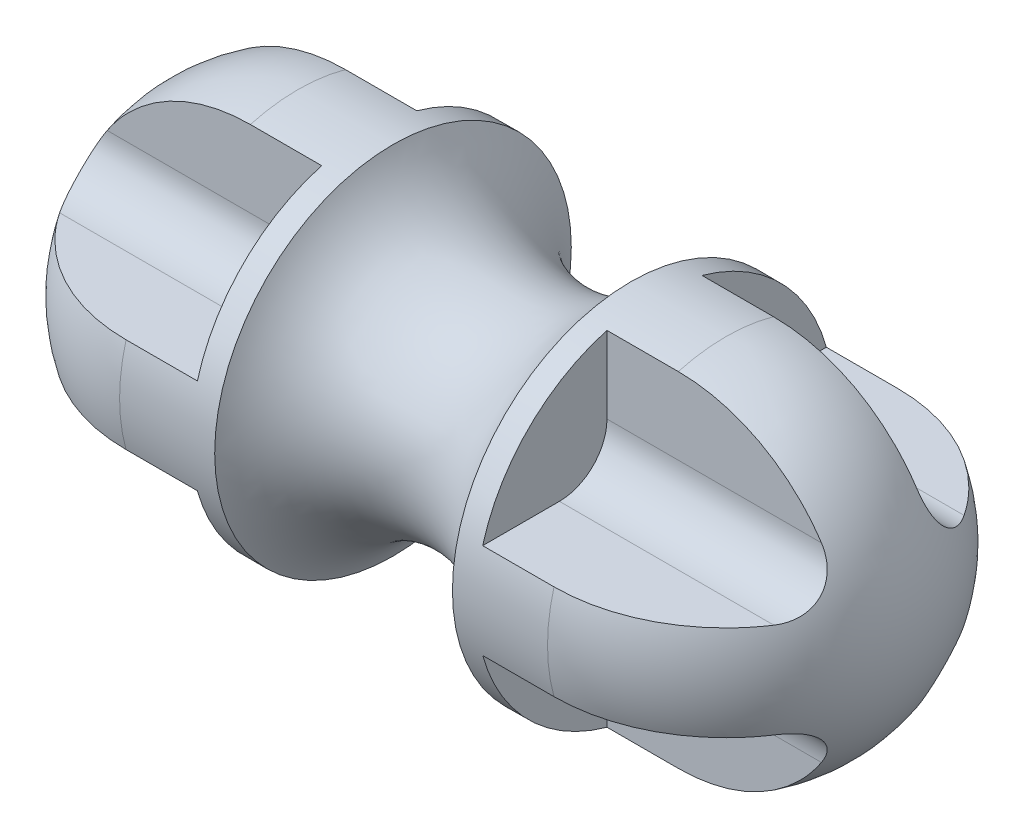
from build123d import *

# Parameters (mm, degrees)
SKETCH_1_W               = 5
SKETCH_1_H               = 37.5
CUT_EXTRUDE_1_DEPTH      = 77.40353395
PATTERN_CIRCULAR_1_COUNT = 4
MIRROR_2_COPY_1_DEPTH    = 77.40353395
MIRROR_2_COPY_2_DEPTH    = 77.40353395
MIRROR_2_COPY_3_DEPTH    = 77.40353395


with BuildPart() as part:
    # 草图1 → 旋转1 (revolve)
    with BuildSketch(Plane(origin=(0, 0, 0), x_dir=(1, 0, 0), z_dir=(0, 1, 0))):
        with BuildLine():
            Line((-82.5, 0), (-30, 0))
            Line((-30, 0), (-30, 37.5))
            Line((-30, 37.5), (-45, 37.5))
            ThreePointArc((-45, 37.5), (-71.516504294, 26.516504294), (-82.5, 0))
        make_face()
        with Locations((-27.5, 18.75)):
            Rectangle(SKETCH_1_W, SKETCH_1_H)
        with BuildLine():
            Line((-25, 0), (0, 0))
            Line((0, 0), (0, 22.5))
            ThreePointArc((0, 22.5), (-14.577379737, 26.537700438), (-25, 37.5))
            Line((-25, 37.5), (-25, 0))
        make_face()
        with BuildLine():
            Line((0, 22.5), (0, 0))
            Line((0, 0), (25, 0))
            Line((25, 0), (25, 37.5))
            ThreePointArc((25, 37.5), (14.577379737, 26.537700438), (0, 22.5))
        make_face()
    revolve_1 = revolve(axis=Axis((0, 0, 0), (-1, 0, 0)))

    # 草图2 → 切除-拉伸1 (cut, through all)
    with BuildSketch(Plane(origin=(-30, 0, 0), x_dir=(0, 0, -1), z_dir=(1, 0, 0))):
        with BuildLine():
            Line((10, 54.755645053), (54.446031679, 54.755645053))
            Line((54.446031679, 54.755645053), (54.446031679, 10))
            Line((54.446031679, 10), (20, 10))
            ThreePointArc((20, 10), (12.928932188, 12.928932188), (10, 20))
            Line((10, 20), (10, 54.755645053))
        make_face()
    cut_extrude_1 = extrude(amount=-CUT_EXTRUDE_1_DEPTH, mode=Mode.SUBTRACT)

    # 阵列(圆周)1: 切除-拉伸1 ×4 about axis
    pattern_circular_1_axis = Axis((0, 0, 0), (1, 0, 0))
    for i in range(1, PATTERN_CIRCULAR_1_COUNT):
        add(cut_extrude_1.rotate(pattern_circular_1_axis, i * 360 / PATTERN_CIRCULAR_1_COUNT), mode=Mode.SUBTRACT)

    # 镜向2: 旋转1, 切除-拉伸1 across plane
    add(revolve_1.mirror(Plane(origin=(0, 0, 0), x_dir=(0, 0, 1), z_dir=(1, 0, 0))))
    add(cut_extrude_1.mirror(Plane(origin=(0, 0, 0), x_dir=(0, 0, 1), z_dir=(1, 0, 0))), mode=Mode.SUBTRACT)

    # 镜向2 copy 1 sketch → 镜向2 copy 1 (cut, through all)
    with BuildSketch(Plane(origin=(30, 0, 0), x_dir=(0, 1, 0), z_dir=(-1, 0, 0))):
        with BuildLine():
            Line((10, -54.755645053), (54.446031679, -54.755645053))
            Line((54.446031679, -54.755645053), (54.446031679, -10))
            Line((54.446031679, -10), (20, -10))
            ThreePointArc((20, -10), (12.928932188, -12.928932188), (10, -20))
            Line((10, -20), (10, -54.755645053))
        make_face()
    extrude(amount=-MIRROR_2_COPY_1_DEPTH, mode=Mode.SUBTRACT)

    # 镜向2 copy 2 sketch → 镜向2 copy 2 (cut, through all)
    with BuildSketch(Plane.ZY.offset(-30)):
        with BuildLine():
            Line((10, -54.755645053), (54.446031679, -54.755645053))
            Line((54.446031679, -54.755645053), (54.446031679, -10))
            Line((54.446031679, -10), (20, -10))
            ThreePointArc((20, -10), (12.928932188, -12.928932188), (10, -20))
            Line((10, -20), (10, -54.755645053))
        make_face()
    extrude(amount=-MIRROR_2_COPY_2_DEPTH, mode=Mode.SUBTRACT)

    # 镜向2 copy 3 sketch → 镜向2 copy 3 (cut, through all)
    with BuildSketch(Plane(origin=(30, 0, 0), x_dir=(0, -1, 0), z_dir=(-1, 0, 0))):
        with BuildLine():
            Line((10, -54.755645053), (54.446031679, -54.755645053))
            Line((54.446031679, -54.755645053), (54.446031679, -10))
            Line((54.446031679, -10), (20, -10))
            ThreePointArc((20, -10), (12.928932188, -12.928932188), (10, -20))
            Line((10, -20), (10, -54.755645053))
        make_face()
    extrude(amount=-MIRROR_2_COPY_3_DEPTH, mode=Mode.SUBTRACT)


solid = part.part
